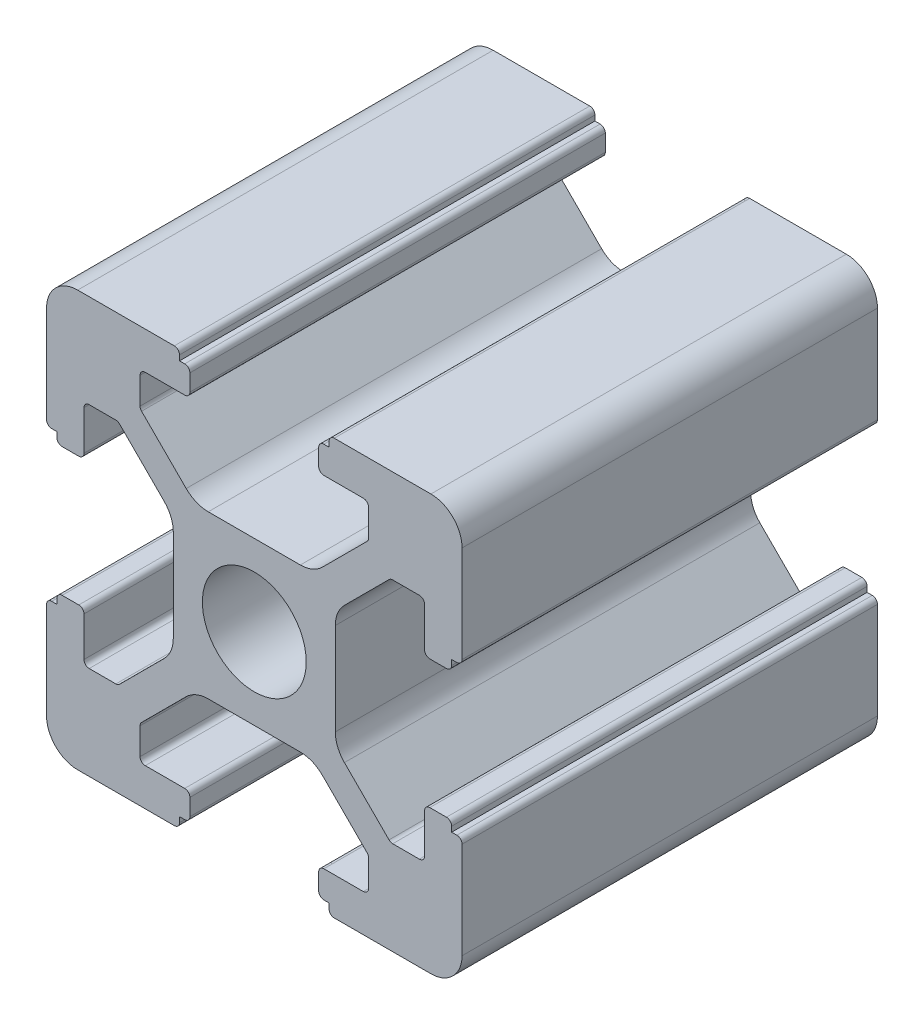
from build123d import *

# Parameters (mm, degrees)
SKETCH_1_R      = 2.5
EXTRUDE_1_DEPTH = 20


with BuildPart() as part:
    # 草图1 → 凸台-拉伸1 (new body)
    with BuildSketch(Plane.XY):
        with BuildLine():
            Line((-8.502261885, -10.002261885), (-3.85, -10.002261885))
            ThreePointArc((-3.85, -10.002261885), (-3.673223305, -9.929038581), (-3.6, -9.752261885))
            Line((-3.6, -9.752261885), (-3.6, -9.502261885))
            Line((-3.6, -9.502261885), (-3.35, -9.502261885))
            ThreePointArc((-3.35, -9.502261885), (-3.173223305, -9.429038581), (-3.1, -9.252261885))
            Line((-3.1, -9.252261885), (-3.1, -8.45))
            ThreePointArc((-3.1, -8.45), (-3.173223305, -8.273223305), (-3.35, -8.2))
            Line((-3.35, -8.2), (-5.25, -8.2))
            ThreePointArc((-5.25, -8.2), (-5.426776695, -8.126776695), (-5.5, -7.95))
            Line((-5.5, -7.95), (-5.5, -6.664213562))
            ThreePointArc((-5.5, -6.664213562), (-5.480969883, -6.568542704), (-5.426776695, -6.487436867))
            Line((-5.426776695, -6.487436867), (-3.278679656, -4.339339828))
            ThreePointArc((-3.278679656, -4.339339828), (-2.792044633, -4.014180701), (-2.218019485, -3.9))
            Line((-2.218019485, -3.9), (2.218019485, -3.9))
            ThreePointArc((2.218019485, -3.9), (2.792044633, -4.014180701), (3.278679656, -4.339339828))
            Line((3.278679656, -4.339339828), (5.426776695, -6.487436867))
            ThreePointArc((5.426776695, -6.487436867), (5.480969883, -6.568542704), (5.5, -6.664213562))
            Line((5.5, -6.664213562), (5.5, -7.95))
            ThreePointArc((5.5, -7.95), (5.426776695, -8.126776695), (5.25, -8.2))
            Line((5.25, -8.2), (3.35, -8.2))
            ThreePointArc((3.35, -8.2), (3.173223305, -8.273223305), (3.1, -8.45))
            Line((3.1, -8.45), (3.1, -9.252261885))
            ThreePointArc((3.1, -9.252261885), (3.173223305, -9.429038581), (3.35, -9.502261885))
            Line((3.35, -9.502261885), (3.6, -9.502261885))
            Line((3.6, -9.502261885), (3.6, -9.752261885))
            ThreePointArc((3.6, -9.752261885), (3.673223305, -9.929038581), (3.85, -10.002261885))
            Line((3.85, -10.002261885), (8.502261885, -10.002261885))
            ThreePointArc((8.502261885, -10.002261885), (9.562922057, -9.562922057), (10.002261885, -8.502261885))
            Line((10.002261885, -8.502261885), (10.002261885, -3.85))
            ThreePointArc((10.002261885, -3.85), (9.929038581, -3.673223305), (9.752261885, -3.6))
            Line((9.752261885, -3.6), (9.502261885, -3.6))
            Line((9.502261885, -3.6), (9.502261885, -3.35))
            ThreePointArc((9.502261885, -3.35), (9.429038581, -3.173223305), (9.252261885, -3.1))
            Line((9.252261885, -3.1), (8.45, -3.1))
            ThreePointArc((8.45, -3.1), (8.273223305, -3.173223305), (8.2, -3.35))
            Line((8.2, -3.35), (8.2, -5.25))
            ThreePointArc((8.2, -5.25), (8.126776695, -5.426776695), (7.95, -5.5))
            Line((7.95, -5.5), (6.664213562, -5.5))
            ThreePointArc((6.664213562, -5.5), (6.568542704, -5.480969883), (6.487436867, -5.426776695))
            Line((6.487436867, -5.426776695), (4.339339828, -3.278679656))
            ThreePointArc((4.339339828, -3.278679656), (4.014180701, -2.792044633), (3.9, -2.218019485))
            Line((3.9, -2.218019485), (3.9, 2.218019485))
            ThreePointArc((3.9, 2.218019485), (4.014180701, 2.792044633), (4.339339828, 3.278679656))
            Line((4.339339828, 3.278679656), (6.487436867, 5.426776695))
            ThreePointArc((6.487436867, 5.426776695), (6.568542704, 5.480969883), (6.664213562, 5.5))
            Line((6.664213562, 5.5), (7.95, 5.5))
            ThreePointArc((7.95, 5.5), (8.126776695, 5.426776695), (8.2, 5.25))
            Line((8.2, 5.25), (8.2, 3.35))
            ThreePointArc((8.2, 3.35), (8.273223305, 3.173223305), (8.45, 3.1))
            Line((8.45, 3.1), (9.252261885, 3.1))
            ThreePointArc((9.252261885, 3.1), (9.429038581, 3.173223305), (9.502261885, 3.35))
            Line((9.502261885, 3.35), (9.502261885, 3.6))
            Line((9.502261885, 3.6), (9.752261885, 3.6))
            ThreePointArc((9.752261885, 3.6), (9.929038581, 3.673223305), (10.002261885, 3.85))
            Line((10.002261885, 3.85), (10.002261885, 8.502261885))
            ThreePointArc((10.002261885, 8.502261885), (9.562922057, 9.562922057), (8.502261885, 10.002261885))
            Line((8.502261885, 10.002261885), (3.85, 10.002261885))
            ThreePointArc((3.85, 10.002261885), (3.673223305, 9.929038581), (3.6, 9.752261885))
            Line((3.6, 9.752261885), (3.6, 9.502261885))
            Line((3.6, 9.502261885), (3.35, 9.502261885))
            ThreePointArc((3.35, 9.502261885), (3.173223305, 9.429038581), (3.1, 9.252261885))
            Line((3.1, 9.252261885), (3.1, 8.45))
            ThreePointArc((3.1, 8.45), (3.173223305, 8.273223305), (3.35, 8.2))
            Line((3.35, 8.2), (5.25, 8.2))
            ThreePointArc((5.25, 8.2), (5.426776695, 8.126776695), (5.5, 7.95))
            Line((5.5, 7.95), (5.5, 6.664213562))
            ThreePointArc((5.5, 6.664213562), (5.480969883, 6.568542704), (5.426776695, 6.487436867))
            Line((5.426776695, 6.487436867), (3.278679656, 4.339339828))
            ThreePointArc((3.278679656, 4.339339828), (2.792044633, 4.014180701), (2.218019485, 3.9))
            Line((2.218019485, 3.9), (-2.218019485, 3.9))
            ThreePointArc((-2.218019485, 3.9), (-2.792044633, 4.014180701), (-3.278679656, 4.339339828))
            Line((-3.278679656, 4.339339828), (-5.426776695, 6.487436867))
            ThreePointArc((-5.426776695, 6.487436867), (-5.480969883, 6.568542704), (-5.5, 6.664213562))
            Line((-5.5, 6.664213562), (-5.5, 7.95))
            ThreePointArc((-5.5, 7.95), (-5.426776695, 8.126776695), (-5.25, 8.2))
            Line((-5.25, 8.2), (-3.35, 8.2))
            ThreePointArc((-3.35, 8.2), (-3.173223305, 8.273223305), (-3.1, 8.45))
            Line((-3.1, 8.45), (-3.1, 9.252261885))
            ThreePointArc((-3.1, 9.252261885), (-3.173223305, 9.429038581), (-3.35, 9.502261885))
            Line((-3.35, 9.502261885), (-3.6, 9.502261885))
            Line((-3.6, 9.502261885), (-3.6, 9.752261885))
            ThreePointArc((-3.6, 9.752261885), (-3.673223305, 9.929038581), (-3.85, 10.002261885))
            Line((-3.85, 10.002261885), (-8.502261885, 10.002261885))
            ThreePointArc((-8.502261885, 10.002261885), (-9.562922057, 9.562922057), (-10.002261885, 8.502261885))
            Line((-10.002261885, 8.502261885), (-10.002261885, 3.85))
            ThreePointArc((-10.002261885, 3.85), (-9.929038581, 3.673223305), (-9.752261885, 3.6))
            Line((-9.752261885, 3.6), (-9.502261885, 3.6))
            Line((-9.502261885, 3.6), (-9.502261885, 3.35))
            ThreePointArc((-9.502261885, 3.35), (-9.429038581, 3.173223305), (-9.252261885, 3.1))
            Line((-9.252261885, 3.1), (-8.45, 3.1))
            ThreePointArc((-8.45, 3.1), (-8.273223305, 3.173223305), (-8.2, 3.35))
            Line((-8.2, 3.35), (-8.2, 5.25))
            ThreePointArc((-8.2, 5.25), (-8.126776695, 5.426776695), (-7.95, 5.5))
            Line((-7.95, 5.5), (-6.664213562, 5.5))
            ThreePointArc((-6.664213562, 5.5), (-6.568542704, 5.480969883), (-6.487436867, 5.426776695))
            Line((-6.487436867, 5.426776695), (-4.339339828, 3.278679656))
            ThreePointArc((-4.339339828, 3.278679656), (-4.014180701, 2.792044633), (-3.9, 2.218019485))
            Line((-3.9, 2.218019485), (-3.9, -2.218019485))
            ThreePointArc((-3.9, -2.218019485), (-4.014180701, -2.792044633), (-4.339339828, -3.278679656))
            Line((-4.339339828, -3.278679656), (-6.487436867, -5.426776695))
            ThreePointArc((-6.487436867, -5.426776695), (-6.568542704, -5.480969883), (-6.664213562, -5.5))
            Line((-6.664213562, -5.5), (-7.95, -5.5))
            ThreePointArc((-7.95, -5.5), (-8.126776695, -5.426776695), (-8.2, -5.25))
            Line((-8.2, -5.25), (-8.2, -3.35))
            ThreePointArc((-8.2, -3.35), (-8.273223305, -3.173223305), (-8.45, -3.1))
            Line((-8.45, -3.1), (-9.252261885, -3.1))
            ThreePointArc((-9.252261885, -3.1), (-9.429038581, -3.173223305), (-9.502261885, -3.35))
            Line((-9.502261885, -3.35), (-9.502261885, -3.6))
            Line((-9.502261885, -3.6), (-9.752261885, -3.6))
            ThreePointArc((-9.752261885, -3.6), (-9.929038581, -3.673223305), (-10.002261885, -3.85))
            Line((-10.002261885, -3.85), (-10.002261885, -8.502261885))
            ThreePointArc((-10.002261885, -8.502261885), (-9.562922057, -9.562922057), (-8.502261885, -10.002261885))
        make_face()
        Circle(SKETCH_1_R, mode=Mode.SUBTRACT)
    extrude(amount=EXTRUDE_1_DEPTH)


solid = part.part
